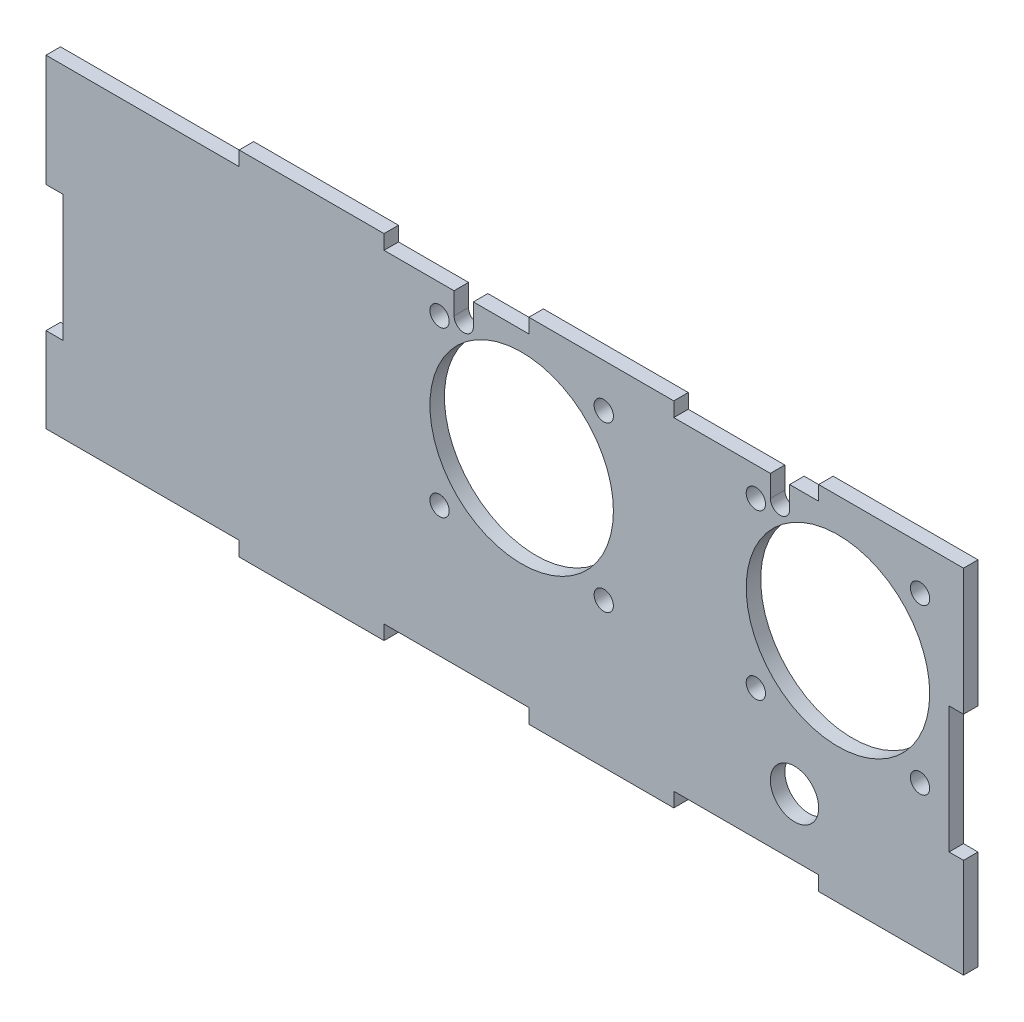
from build123d import *

# Parameters (mm, degrees)
SKETCH1_R           = 5
BOSS_EXTRUDE1_DEPTH = 3
SKETCH2_R           = 2
SKETCH2_R_2         = 19
SKETCH2_W           = 4
SKETCH2_H           = 3
CUT_EXTRUDE1_DEPTH  = 10


with BuildPart() as part:
    # Sketch1 → Boss-Extrude1 (new body)
    with BuildSketch(Plane.XY):
        Polygon((30, 70), (0, 70), (-10, 70), (-10, 46.8), (-6.473616306, 46.8), (-6.473616306, 20.6), (-10, 20.6), (-10, 3), (0, 3), (30, 3), (30, 0), (60, 0), (60, 3), (90, 3), (90, 0), (120, 0), (120, 3), (150, 3), (150, 0), (180, 0), (180, 20.6), (177, 20.6), (177, 46.8), (180, 46.8), (180, 73), (150, 73), (150, 70), (120, 70), (120, 73), (90, 73), (90, 70), (60, 70), (60, 73), (30, 73), align=None)
        with Locations((145, 15)):
            Circle(SKETCH1_R, mode=Mode.SUBTRACT)
    extrude(amount=BOSS_EXTRUDE1_DEPTH)

    # Sketch2 → Cut-Extrude1 (cut)
    with BuildSketch(Plane.XY.offset(3)):
        with Locations((105.5, 64)):
            Circle(SKETCH2_R)
        with Locations((154, 47)):
            Circle(SKETCH2_R_2)
        with Locations((88.5, 47)):
            Circle(SKETCH2_R_2)
        with Locations((142, 68.5)):
            Rectangle(SKETCH2_W, SKETCH2_H)
        with BuildLine():
            Line((144, 67), (140, 67))
            Line((140, 67), (140, 65.5))
            ThreePointArc((140, 65.5), (142, 63.5), (144, 65.5))
            Line((144, 65.5), (144, 67))
        make_face()
        with Locations((71.5, 64)):
            Circle(SKETCH2_R)
        with Locations((71.5, 30)):
            Circle(SKETCH2_R)
        with Locations((105.5, 30)):
            Circle(SKETCH2_R)
        with Locations((137, 30)):
            Circle(SKETCH2_R)
        with Locations((171, 30)):
            Circle(SKETCH2_R)
        with Locations((171, 64)):
            Circle(SKETCH2_R)
        with Locations((137, 64)):
            Circle(SKETCH2_R)
        with BuildLine():
            Line((74.5, 70), (78.5, 70))
            Line((78.5, 70), (78.5, 65.5))
            ThreePointArc((78.5, 65.5), (76.5, 63.5), (74.5, 65.5))
            Line((74.5, 65.5), (74.5, 70))
        make_face()
    extrude(amount=-CUT_EXTRUDE1_DEPTH, mode=Mode.SUBTRACT)


solid = part.part
